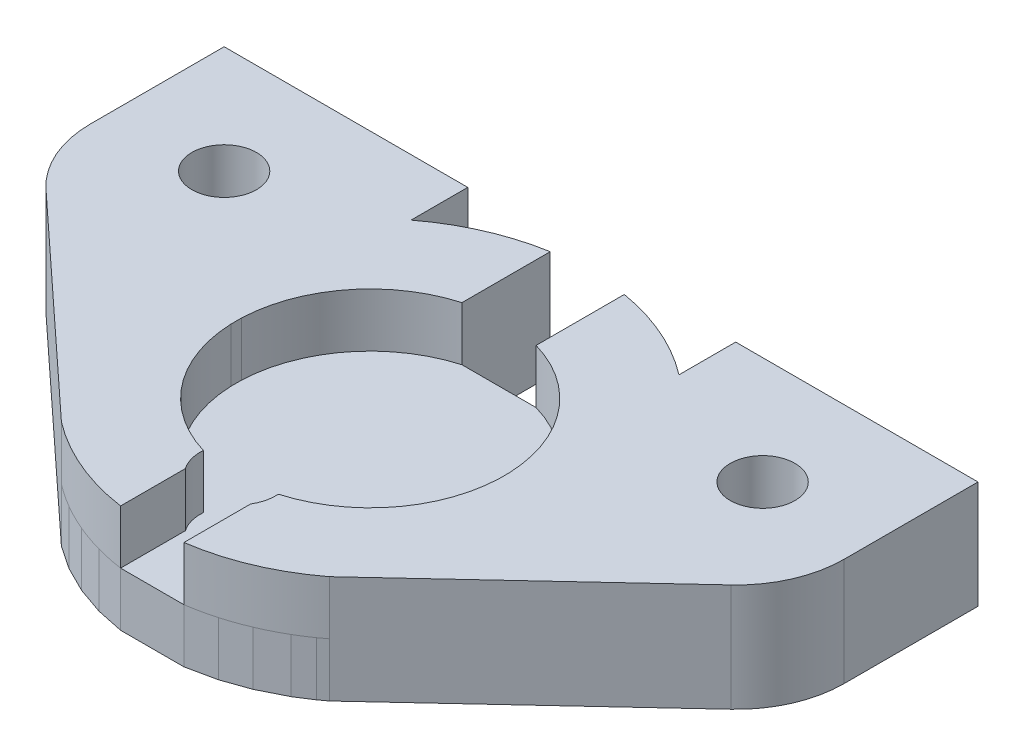
from build123d import *

# Parameters (mm, degrees)
SKETCH_1_W             = 70
SKETCH_1_H             = 43
EXTRUDE_1_DEPTH        = 10
SKETCH_8_W             = 24.88
SKETCH_8_H             = 5
CUT_EXTRUDE_4_DEPTH    = 57.338264084
EXTRUDE_1_2_DEPTH      = 5
EXTRUDE_1_2_DEPTH_BACK = 2
SKETCH_11_R            = 20.45
SKETCH_11_R_2          = 12.45
CUT_EXTRUDE_6_DEPTH    = 5
CUT_EXTRUDE_7_DEPTH    = 5
SKETCH_16_W            = 5.88
SKETCH_16_H            = 11
CUT_EXTRUDE_8_DEPTH    = 5
SKETCH_17_W            = 5.88
SKETCH_17_H            = 8.352111755
CUT_EXTRUDE_9_DEPTH    = 5
CUT_EXTRUDE_10_DEPTH   = 5
CUT_EXTRUDE_11_DEPTH   = 5
SKETCH_21_R            = 3
CUT_EXTRUDE_12_DEPTH   = 43.275879648
SKETCH_22_R            = 3
CUT_EXTRUDE_13_DEPTH   = 43.275879648
SKETCH_24_R            = 3.51
CUT_EXTRUDE_15_DEPTH   = 7
SKETCH_27_W            = 5.88
SKETCH_27_H            = 8.139673367
CUT_EXTRUDE_16_DEPTH   = 7
SKETCH_31_W            = 6.88
SKETCH_31_H            = 8.484679277
CUT_EXTRUDE_21_DEPTH   = 14.5
CUT_EXTRUDE_22_DEPTH   = 42.379342672
CUT_EXTRUDE_23_DEPTH   = 42.379342672
CUT_EXTRUDE_24_DEPTH   = 42.379342672
CUT_EXTRUDE_25_DEPTH   = 14.5
CUT_EXTRUDE_26_DEPTH   = 14.5
CUT_EXTRUDE_27_DEPTH   = 14.5
FILLET_1_R             = 10


with BuildPart() as part:
    # 草圖1 → Extrude 1 (new body)
    with BuildSketch(Plane(origin=(0, 0, 0), x_dir=(1, 0, 0), z_dir=(0, 1, 0))):
        Rectangle(SKETCH_1_W, SKETCH_1_H)
    extrude(amount=EXTRUDE_1_DEPTH)

    # 草圖8 → 除料-伸長4 (cut, through all)
    with BuildSketch(Plane.XY.offset(21.5)):
        with Locations((0.06, 7.5)):
            Rectangle(SKETCH_8_W, SKETCH_8_H)
    extrude(amount=-CUT_EXTRUDE_4_DEPTH, mode=Mode.SUBTRACT)

    # 草圖11 → Extrude 1 2 (add, two sides: drawn at the far end of the back side and taken through both)
    with BuildSketch(Plane(origin=(0, 5, 0), x_dir=(1, 0, 0), z_dir=(0, 1, 0)).offset(-EXTRUDE_1_2_DEPTH_BACK)):
        with Locations((0.06, 0)):
            Circle(SKETCH_11_R)
        with Locations((0.06, 0)):
            Circle(SKETCH_11_R_2, mode=Mode.SUBTRACT)
    extrude(amount=EXTRUDE_1_2_DEPTH + EXTRUDE_1_2_DEPTH_BACK)

    # 草圖14 → 除料-伸長6 (cut)
    with BuildSketch(Plane(origin=(0, 5, 0), x_dir=(1, 0, 0), z_dir=(0, 1, 0))):
        Polygon((0.06, -20.45), (12.5, -20.45), (12.5, -21.5), (-12.38, -21.5), (-12.38, -20.45), align=None)
    extrude(amount=-CUT_EXTRUDE_6_DEPTH, mode=Mode.SUBTRACT)

    # 草圖15 → 除料-伸長7 (cut)
    with BuildSketch(Plane(origin=(0, 5, 0), x_dir=(1, 0, 0), z_dir=(0, 1, 0))):
        Polygon((0.06, 20.45), (12.5, 20.45), (12.5, 21.5), (-12.38, 21.5), (-12.38, 20.45), align=None)
    extrude(amount=-CUT_EXTRUDE_7_DEPTH, mode=Mode.SUBTRACT)

    # 草圖16 → 除料-伸長8 (cut)
    with BuildSketch(Plane(origin=(0, 10, 0), x_dir=(1, 0, 0), z_dir=(0, 1, 0))):
        with Locations((0.06, 17.597888245)):
            Rectangle(SKETCH_16_W, SKETCH_16_H)
    extrude(amount=-CUT_EXTRUDE_8_DEPTH, mode=Mode.SUBTRACT)

    # 草圖17 → 除料-伸長9 (cut)
    with BuildSketch(Plane(origin=(0, 10, 0), x_dir=(1, 0, 0), z_dir=(0, 1, 0))):
        with Locations((0.06, -16.273944123)):
            Rectangle(SKETCH_17_W, SKETCH_17_H)
    extrude(amount=-CUT_EXTRUDE_9_DEPTH, mode=Mode.SUBTRACT)

    # 草圖19 → 除料-伸長10 (cut)
    with BuildSketch(Plane(origin=(0, 5, 0), x_dir=(1, 0, 0), z_dir=(0, 1, 0))):
        Polygon((-2.88, 20.237561612), (-2.88, 20.45), (2.98755849, 20.45), (3, 20.237561612), align=None)
    extrude(amount=-CUT_EXTRUDE_10_DEPTH, mode=Mode.SUBTRACT)

    # 草圖20 → 除料-伸長11 (cut)
    with BuildSketch(Plane(origin=(0, 5, 0), x_dir=(1, 0, 0), z_dir=(0, 1, 0))):
        Polygon((3, -20.237561612), (3, -20.45), (-2.887827835, -20.45), (-2.88, -20.237561612), align=None)
    extrude(amount=-CUT_EXTRUDE_11_DEPTH, mode=Mode.SUBTRACT)

    # 草圖21 → 除料-伸長12 (cut, through all)
    with BuildSketch(Plane(origin=(0, 10, 0), x_dir=(1, 0, 0), z_dir=(0, 1, 0))):
        with Locations(Location((-25, 11.5, 0), (0, 0, 270))):
            Circle(SKETCH_21_R)
    extrude(amount=-CUT_EXTRUDE_12_DEPTH, mode=Mode.SUBTRACT)

    # 草圖22 → 除料-伸長13 (cut, through all)
    with BuildSketch(Plane(origin=(0, 10, 0), x_dir=(1, 0, 0), z_dir=(0, 1, 0))):
        with Locations(Location((25, 11.5, 0), (0, 0, 270))):
            Circle(SKETCH_22_R)
    extrude(amount=-CUT_EXTRUDE_13_DEPTH, mode=Mode.SUBTRACT)

    # 草圖24 → 除料-伸長15 (cut)
    with BuildSketch(Plane(origin=(0, 5, 0), x_dir=(1, 0, 0), z_dir=(0, 1, 0))):
        with Locations((0, -12.216230782)):
            Circle(SKETCH_24_R)
    extrude(amount=CUT_EXTRUDE_15_DEPTH, mode=Mode.SUBTRACT)

    # 草圖27 → 除料-伸長16 (cut)
    with BuildSketch(Plane(origin=(0, 5, 0), x_dir=(1, 0, 0), z_dir=(0, 1, 0))):
        with Locations((0.06, 16.167724929)):
            Rectangle(SKETCH_27_W, SKETCH_27_H)
    extrude(amount=-CUT_EXTRUDE_16_DEPTH, mode=Mode.SUBTRACT)

    # 草圖31 → 除料-伸長21 (cut)
    with BuildSketch(Plane(origin=(0, 10, 0), x_dir=(1, 0, 0), z_dir=(0, 1, 0))):
        with Locations((0.06, 16.207660362)):
            Rectangle(SKETCH_31_W, SKETCH_31_H)
    extrude(amount=-CUT_EXTRUDE_21_DEPTH, mode=Mode.SUBTRACT)

    # 草圖32 → 除料-伸長22 (cut, through all)
    with BuildSketch(Plane(origin=(0, 5, 0), x_dir=(1, 0, 0), z_dir=(0, 1, 0))):
        Polygon((12.5, 20.45), (12.5, 16.231109019), (10.42274151, 17.629976982), (8.239234926, 18.743068479), (5.957708545, 19.581101448), (3.5, 20.158593701), (3.5, 20.45), align=None)
    extrude(amount=-CUT_EXTRUDE_22_DEPTH, mode=Mode.SUBTRACT)

    # 草圖33 → 除料-伸長23 (cut, through all)
    with BuildSketch(Plane(origin=(0, 5, 0), x_dir=(1, 0, 0), z_dir=(0, 1, 0))):
        Polygon((-12.38, 16.231109019), (-12.38, 20.45), (-3.38, 20.45), (-3.38, 20.158593701), (-5.787343839, 19.596200398), (-8.119234926, 18.743068479), (-10.338150934, 17.609115741), align=None)
    extrude(amount=-CUT_EXTRUDE_23_DEPTH, mode=Mode.SUBTRACT)

    # 草圖34 → 除料-伸長24 (cut, through all)
    with BuildSketch(Plane(origin=(0, 5, 0), x_dir=(1, 0, 0), z_dir=(0, 1, 0))):
        Polygon((-12.38, -20.45), (-12.38, -16.231109019), (-10.215137429, -17.681177869), (-7.886635489, -18.842862957), (-5.420645085, -19.701904209), (-2.88, -20.237561612), (-2.887827835, -20.45), align=None)
    extrude(amount=-CUT_EXTRUDE_24_DEPTH, mode=Mode.SUBTRACT)

    # 草圖35 → 除料-伸長25 (cut)
    with BuildSketch(Plane(origin=(0, 5, 0), x_dir=(1, 0, 0), z_dir=(0, 1, 0))):
        Polygon((3, -20.237561612), (3, -20.45), (12.5, -20.45), (12.5, -16.231109019), (11.802562641, -16.742602026), (10.376101904, -17.657308444), (8.006635489, -18.842862957), (5.650656404, -19.670970006), align=None)
    extrude(amount=-CUT_EXTRUDE_25_DEPTH, mode=Mode.SUBTRACT)

    # 草圖37 → 除料-伸長26 (cut)
    with BuildSketch(Plane(origin=(0, 10, 0), x_dir=(1, 0, 0), z_dir=(0, 1, 0))):
        Polygon((-35, -21.5), (-12.38, -21.5), (-12.38, -16.231109019), (-35, 4.72072635), align=None)
    extrude(amount=-CUT_EXTRUDE_26_DEPTH, mode=Mode.SUBTRACT)

    # 草圖38 → 除料-伸長27 (cut)
    with BuildSketch(Plane(origin=(0, 10, 0), x_dir=(1, 0, 0), z_dir=(0, 1, 0))):
        Polygon((35, 4.72072635), (35, -21.5), (12.5, -21.5), (12.5, -16.231109019), align=None)
    extrude(amount=-CUT_EXTRUDE_27_DEPTH, mode=Mode.SUBTRACT)

    # 圓角1
    fillet_1_edges = [part.edges().sort_by_distance(p)[0] for p in [
        (-35, 5, -4.72072635),
        (35, 5, -4.72072635),
    ]]
    fillet(fillet_1_edges, radius=FILLET_1_R)


solid = part.part
